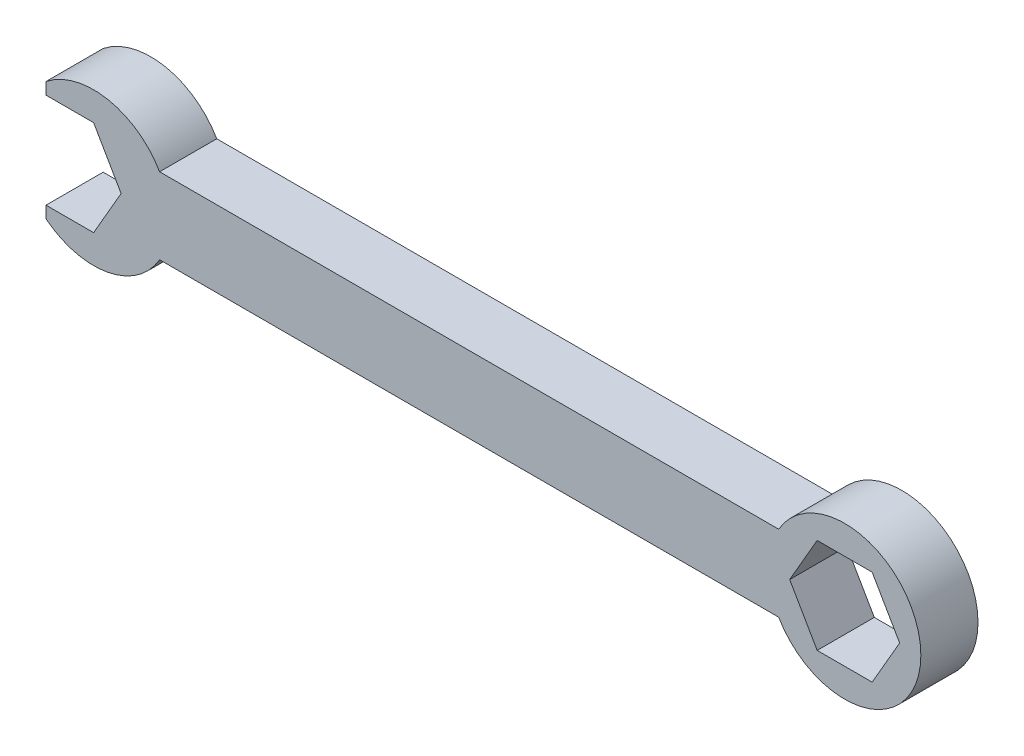
from build123d import *

# Parameters (mm, degrees)
SKETCH2_R           = 10.16
BOSS_EXTRUDE1_DEPTH = 7.62


with BuildPart() as part:
    # Sketch2 → Boss-Extrude1 (new body)
    # profile 1 of 3: a face of its own
    with BuildSketch(Plane.XY):
        with BuildLine():
            Line((87.682643893, 5.08), (5.132643893, 5.08))
            ThreePointArc((5.132643893, 5.08), (6.493825791, 0), (5.132643893, -5.08))
            Line((5.132643893, -5.08), (87.682643893, -5.08))
            ThreePointArc((87.682643893, -5.08), (86.321461996, 0), (87.682643893, 5.08))
        make_face()
    # profile 2 of 3: a face of its own
    with BuildSketch(Plane.XY):
        with BuildLine():
            ThreePointArc((-10.016174209, -7.931147458), (6.493825791, 0), (-10.016174209, 7.931147458))
            Line((-10.016174209, 7.931147458), (-10.016174209, 6.35))
            Line((-10.016174209, 6.35), (-3.666174209, 6.35))
            Line((-3.666174209, 6.35), (0, 0))
            Line((0, 0), (-3.666174209, -6.35))
            Line((-3.666174209, -6.35), (-10.016174209, -6.35))
            Line((-10.016174209, -6.35), (-10.016174209, -7.931147458))
        make_face()
    # profile 3 of 3: a face of its own
    with BuildSketch(Plane.XY):
        with Locations((96.481461996, 0)):
            Circle(SKETCH2_R)
        Polygon((100.147636205, -6.35), (103.813810414, 0), (100.147636205, 6.35), (92.815287786, 6.35), (89.149113577, 0), (92.815287786, -6.35), align=None, mode=Mode.SUBTRACT)
    extrude(amount=BOSS_EXTRUDE1_DEPTH)


solid = part.part
